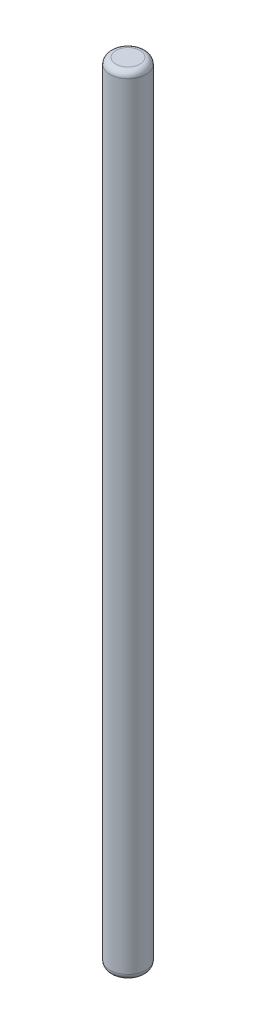
from build123d import *

# Parameters (mm, degrees)
SKETCH1_R           = 3
BOSS_EXTRUDE1_DEPTH = 132
FILLET1_R           = 1


with BuildPart() as part:
    # Sketch1 → Boss-Extrude1 (new body)
    with BuildSketch(Plane(origin=(0, 0, 0), x_dir=(1, 0, 0), z_dir=(0, 1, 0))):
        with Locations(Location((0, 0, 0), (0, 0, 270))):
            Circle(SKETCH1_R)
    extrude(amount=BOSS_EXTRUDE1_DEPTH)

    # Fillet1
    fillet1_edges = [part.edges().sort_by_distance(p)[0] for p in [
        (0, 0, -3),
        (0, 132, -3),
    ]]
    fillet(fillet1_edges, radius=FILLET1_R)


solid = part.part
